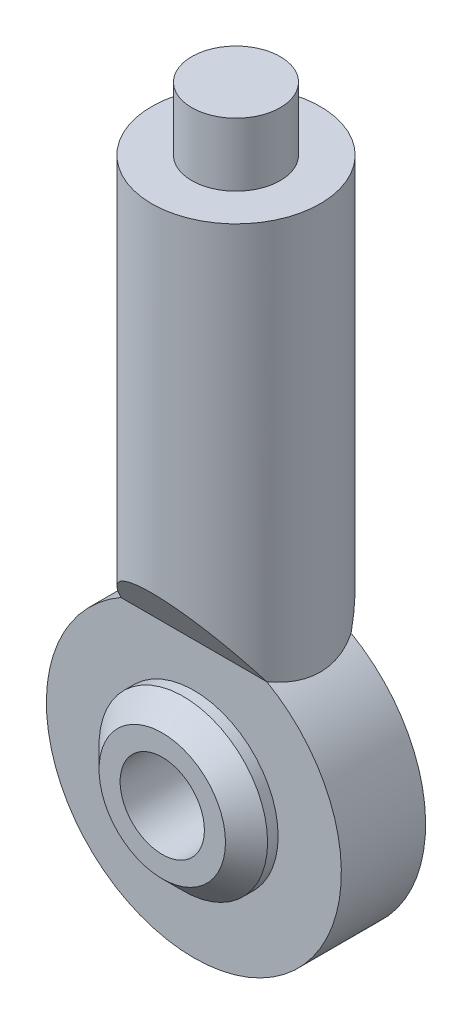
from build123d import *
from build123d.topology import SkipClean

# Parameters (mm, degrees)
SKETCH_1_R          = 7
SKETCH_1_R_2        = 4
EXTRUDE_1_DEPTH     = 2
SKETCH_2_R          = 4
SKETCH_2_R_2        = 2
EXTRUDE_2_DEPTH     = 3.5
CHAMFER_1_SIZE      = 1
SKETCH_4_R          = 4
EXTRUDE_3_DEPTH     = 20
CUT_EXTRUDE_1_DEPTH = 5
CUT_EXTRUDE_2_DEPTH = 5
SKETCH_9_R          = 2.1
EXTRUDE_4_DEPTH     = 3


with BuildPart() as part:
    # 草图1 → 凸台-拉伸1 (new, symmetric)
    with BuildSketch(Plane.XY):
        Circle(SKETCH_1_R)
        Circle(SKETCH_1_R_2, mode=Mode.SUBTRACT)
    extrude(amount=EXTRUDE_1_DEPTH, both=True)

    # 草图2 → 凸台-拉伸2 (add, symmetric)
    with BuildSketch(Plane.XY):
        Circle(SKETCH_2_R)
        Circle(SKETCH_2_R_2, mode=Mode.SUBTRACT)
    extrude(amount=EXTRUDE_2_DEPTH, both=True)

    # 倒角1
    chamfer_1_edges = [part.edges().sort_by_distance(p)[0] for p in [
        (-4, 0, -3.5),
        (-4, 0, 3.5),
    ]]
    chamfer(chamfer_1_edges, length=CHAMFER_1_SIZE)

    # 草图4 → 凸台-拉伸3 (add)
    with BuildSketch(Plane(origin=(0, 25, 0), x_dir=(1, 0, 0), z_dir=(0, 1, 0))):
        with Locations(Location((0, 0, 0), (0, 0, 270))):
            Circle(SKETCH_4_R)
    extrude(amount=-EXTRUDE_3_DEPTH)

    # 草图7 → 切除-拉伸1 (cut, symmetric)
    with BuildSketch(Plane(origin=(0, 0, 0), x_dir=(0, 0, -1), z_dir=(1, 0, 0))):
        Polygon((2, 5), (4, 9), (4, 5), align=None)
        Polygon((-2, 5), (-4, 9), (-4, 5), align=None)
    extrude(amount=CUT_EXTRUDE_1_DEPTH, both=True, mode=Mode.SUBTRACT)

    # 草图8 → 切除-拉伸2 (cut, symmetric)
    with SkipClean():  # the faces are left unmerged after this step: merging them gives an invalid solid
        with BuildSketch(Plane(origin=(0, 0, 0), x_dir=(0, 0, -1), z_dir=(1, 0, 0))):
            Polygon((-2, 5), (-2, 6.08276253), (-4, 9), align=None)
            Polygon((2, 5), (2, 6.08276253), (4, 9), align=None)
        extrude(amount=CUT_EXTRUDE_2_DEPTH, both=True, mode=Mode.SUBTRACT)

    # 草图9 → 凸台-拉伸4 (add)
    with SkipClean():  # the faces are left unmerged after this step: merging them gives an invalid solid
        with BuildSketch(Plane(origin=(0, 25, 0), x_dir=(1, 0, 0), z_dir=(0, 1, 0))):
            with Locations(Location((0, 0, 0), (0, 0, 270))):
                Circle(SKETCH_9_R)
        extrude(amount=EXTRUDE_4_DEPTH)


solid = part.part
